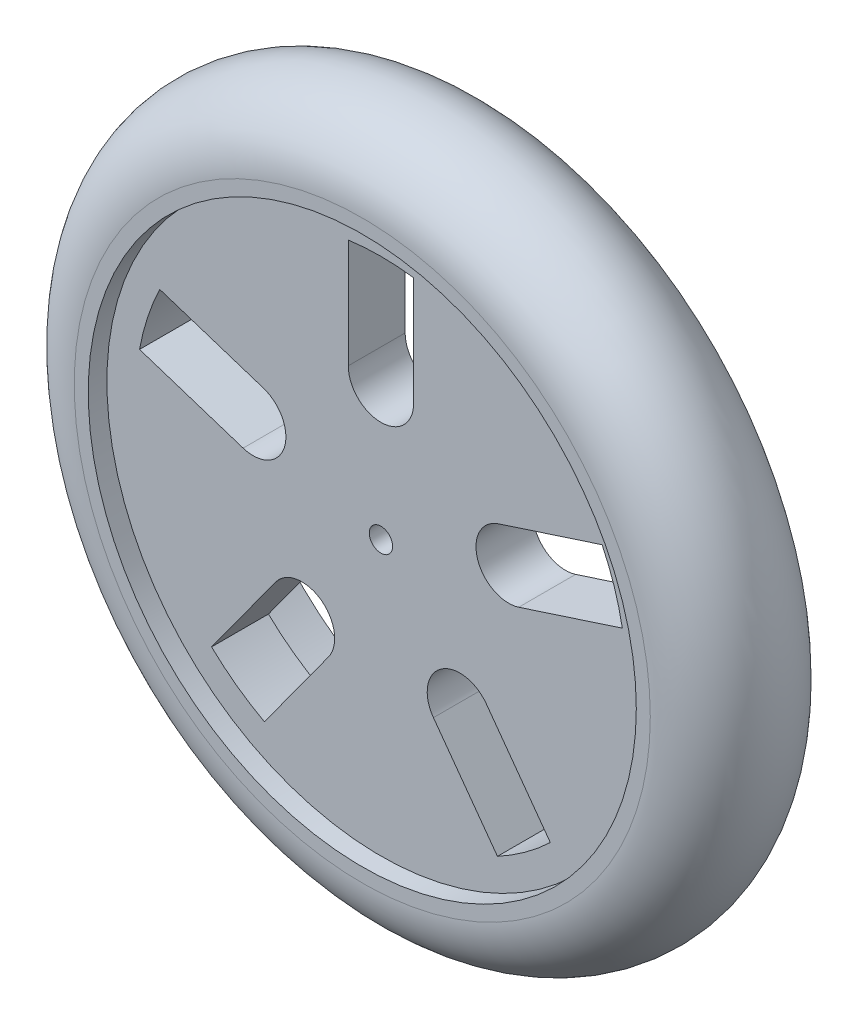
from build123d import *

# Parameters (mm, degrees)
SKETCH2_R      = 7.9375
EXTRUDE1_DEPTH = 354.091885747
SKETCH3_R      = 186.436
SKETCH3_R_2    = 12.7
EXTRUDE2_DEPTH = 12.2936
SKETCH4_R      = 186.436
SKETCH4_R_2    = 12.7
EXTRUDE4_DEPTH = 26.9875
EXTRUDE5_START = -12.7
SKETCH5_R      = 186.436
EXTRUDE5_DEPTH = 12.7
EXTRUDE6_DEPTH = 351.045637854


with BuildPart() as part:
    # Sketch1 → Revolve1 (revolve)
    with BuildSketch(Plane(origin=(0, 0, 0), x_dir=(0, 0, -1), z_dir=(1, 0, 0)), mode=Mode.PRIVATE) as revolve1_sk:
        with BuildLine():
            Line((45.339, 0), (-45.339, 0))
            Line((-45.339, 0), (-45.339, 195.961))
            ThreePointArc((-45.339, 195.961), (0, 241.3), (45.339, 195.961))
            Line((45.339, 195.961), (45.339, 0))
        make_face()
    revolve(revolve1_sk.sketch.rotate(Axis((0, 0, 45.339), (0, 0, -1)), 90), axis=Axis((0, 0, 45.339), (0, 0, -1)))

    # Sketch2 → Extrude1 (cut, through all)
    with BuildSketch(Plane.XY.offset(45.339)):
        Circle(SKETCH2_R)
    extrude(amount=-EXTRUDE1_DEPTH, mode=Mode.SUBTRACT)

    # Sketch3 → Extrude2 (cut)
    with BuildSketch(Plane(origin=(0, 0, -45.339), x_dir=(-1, 0, 0), z_dir=(0, 0, -1))):
        Circle(SKETCH3_R)
        Circle(SKETCH3_R_2, mode=Mode.SUBTRACT)
    extrude(amount=-EXTRUDE2_DEPTH, mode=Mode.SUBTRACT)

    # Sketch4 → Extrude4 (cut)
    with BuildSketch(Plane(origin=(0, 0, -33.0454), x_dir=(-1, 0, 0), z_dir=(0, 0, -1))):
        Circle(SKETCH4_R)
        Circle(SKETCH4_R_2, mode=Mode.SUBTRACT)
    extrude(amount=-EXTRUDE4_DEPTH, mode=Mode.SUBTRACT)

    # Sketch5 → Extrude5 (cut)
    with BuildSketch(Plane.XY.offset(45.339).offset(EXTRUDE5_START)):
        with Locations(Location((0, 0, 0), (0, 0, 180))):
            Circle(SKETCH5_R)
    extrude(amount=EXTRUDE5_DEPTH, mode=Mode.SUBTRACT)

    # Sketch6 → Extrude6 (cut, through all)
    with BuildSketch(Plane.XY.offset(32.639)):
        with BuildLine():
            Line((150.489255243, 72.265671034), (80.015659908, 49.367411845))
            ThreePointArc((80.015659908, 49.367411845), (65.746331533, 21.36227807), (93.751465308, 7.092949695))
            Line((93.751465308, 7.092949695), (164.225060643, 29.991208884))
            ThreePointArc((164.225060643, 29.991208884), (158.770455984, 51.587648329), (150.489255243, 72.265671034))
        make_face()
        with BuildLine():
            Line((-22.225, 165.455107291), (-22.225, 91.354783989))
            ThreePointArc((-22.225, 91.354783989), (0, 69.129783989), (22.225, 91.354783989))
            Line((22.225, 91.354783989), (22.225, 165.455107291))
            ThreePointArc((22.225, 165.455107291), (0, 166.941136793), (-22.225, 165.455107291))
        make_face()
        with BuildLine():
            Line((115.232474682, -120.792466372), (71.677397455, -60.844045532))
            ThreePointArc((71.677397455, -60.844045532), (40.633467523, -55.927170065), (35.716592055, -86.971099997))
            Line((35.716592055, -86.971099997), (79.271669282, -146.919520837))
            ThreePointArc((79.271669282, -146.919520837), (98.125538208, -135.058216725), (115.232474682, -120.792466372))
        make_face()
        with BuildLine():
            Line((-79.271669282, -146.919520837), (-35.716592055, -86.971099997))
            ThreePointArc((-35.716592055, -86.971099997), (-40.633467523, -55.927170065), (-71.677397455, -60.844045532))
            Line((-71.677397455, -60.844045532), (-115.232474682, -120.792466372))
            ThreePointArc((-115.232474682, -120.792466372), (-98.125538208, -135.058216725), (-79.271669282, -146.919520837))
        make_face()
        with BuildLine():
            Line((-164.225060643, 29.991208884), (-93.751465308, 7.092949695))
            ThreePointArc((-93.751465308, 7.092949695), (-65.746331533, 21.36227807), (-80.015659908, 49.367411845))
            Line((-80.015659908, 49.367411845), (-150.489255243, 72.265671034))
            ThreePointArc((-150.489255243, 72.265671034), (-158.770455984, 51.587648329), (-164.225060643, 29.991208884))
        make_face()
    extrude(amount=-EXTRUDE6_DEPTH, mode=Mode.SUBTRACT)


solid = part.part
